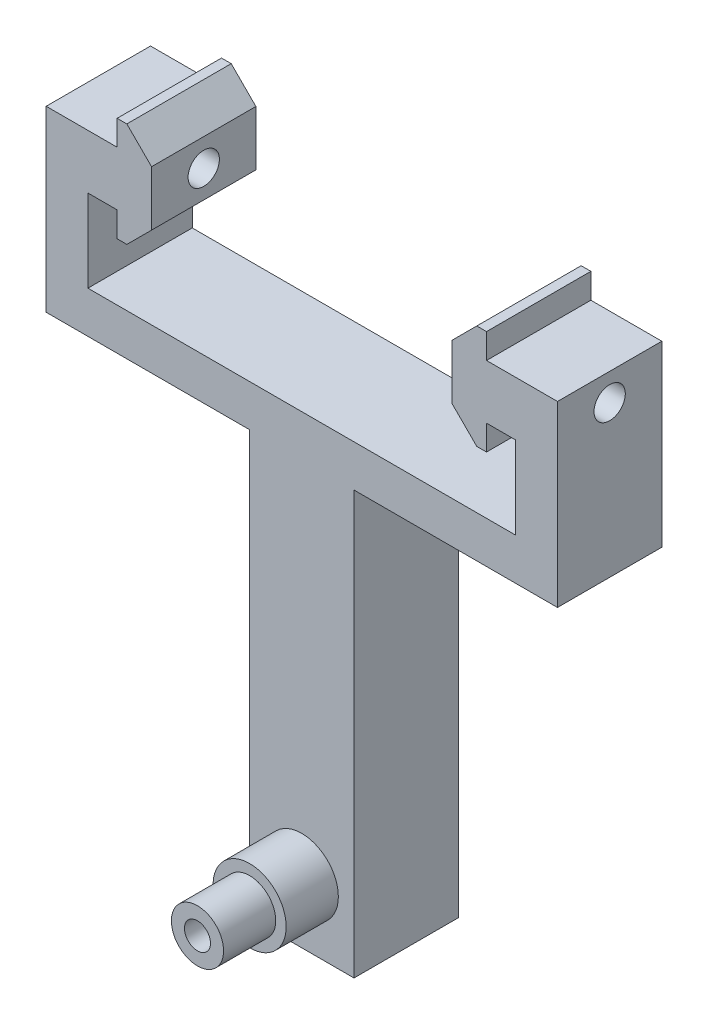
from build123d import *

# Parameters (mm, degrees)
BOSS_EXTRUDE1_DEPTH = 10
SKETCH2_R           = 1.5
CUT_EXTRUDE1_DEPTH  = 13
CUT_EXTRUDE2_START  = -13
SKETCH3_R           = 1.5
CUT_EXTRUDE2_DEPTH  = 13
SKETCH4_R           = 2.5
BOSS_EXTRUDE2_DEPTH = 10
SKETCH5_R           = 3.5
BOSS_EXTRUDE3_DEPTH = 5
SKETCH6_R           = 1.25
CUT_EXTRUDE3_DEPTH  = 4


with BuildPart() as part:
    # Sketch1 → Boss-Extrude1 (new body)
    with BuildSketch(Plane.XY):
        Polygon((-14.5, 2.6), (-7.7, 2.6), (-7.7, 5), (-6.767766953, 5), (-4.4, 2.632233047), (-4.4, -2.632233047), (-6.767766953, -5), (-7.7, -5), (-7.7, -2.6), (-10.5, -2.6), (-10.5, -10.5), (30.5, -10.5), (30.5, -2.6), (27.7, -2.6), (27.7, -5), (26.767766953, -5), (24.4, -2.632233047), (24.4, 2.632233047), (26.767766953, 5), (27.7, 5), (27.7, 2.6), (34.5, 2.6), (34.5, -14.5), (15, -14.5), (15, -55), (5, -55), (5, -14.5), (-14.5, -14.5), align=None)
    extrude(amount=BOSS_EXTRUDE1_DEPTH)

    # Sketch2 → Cut-Extrude1 (cut)
    with BuildSketch(Plane.ZY.offset(14.5)):
        with Locations(Location((5, 0, 0), (0, 0, 270))):
            Circle(SKETCH2_R)
    extrude(amount=-CUT_EXTRUDE1_DEPTH, mode=Mode.SUBTRACT)

    # Sketch3 → Cut-Extrude2 (cut)
    with BuildSketch(Plane(origin=(34.5, 0, 0), x_dir=(0, 0, -1), z_dir=(1, 0, 0)).offset(CUT_EXTRUDE2_START)):
        with Locations(Location((-5, 0, 0), (0, 0, 270))):
            Circle(SKETCH3_R)
    extrude(amount=CUT_EXTRUDE2_DEPTH, mode=Mode.SUBTRACT)

    # Sketch4 → Boss-Extrude2 (add)
    with BuildSketch(Plane.XY.offset(10)):
        with Locations((10, -49)):
            Circle(SKETCH4_R)
    extrude(amount=BOSS_EXTRUDE2_DEPTH)

    # Sketch5 → Boss-Extrude3 (add)
    with BuildSketch(Plane.XY.offset(10)):
        with Locations((10, -49)):
            Circle(SKETCH5_R)
    extrude(amount=BOSS_EXTRUDE3_DEPTH)

    # Sketch6 → Cut-Extrude3 (cut)
    with BuildSketch(Plane.XY.offset(20)):
        with Locations((10, -49)):
            Circle(SKETCH6_R)
    extrude(amount=-CUT_EXTRUDE3_DEPTH, mode=Mode.SUBTRACT)


solid = part.part
